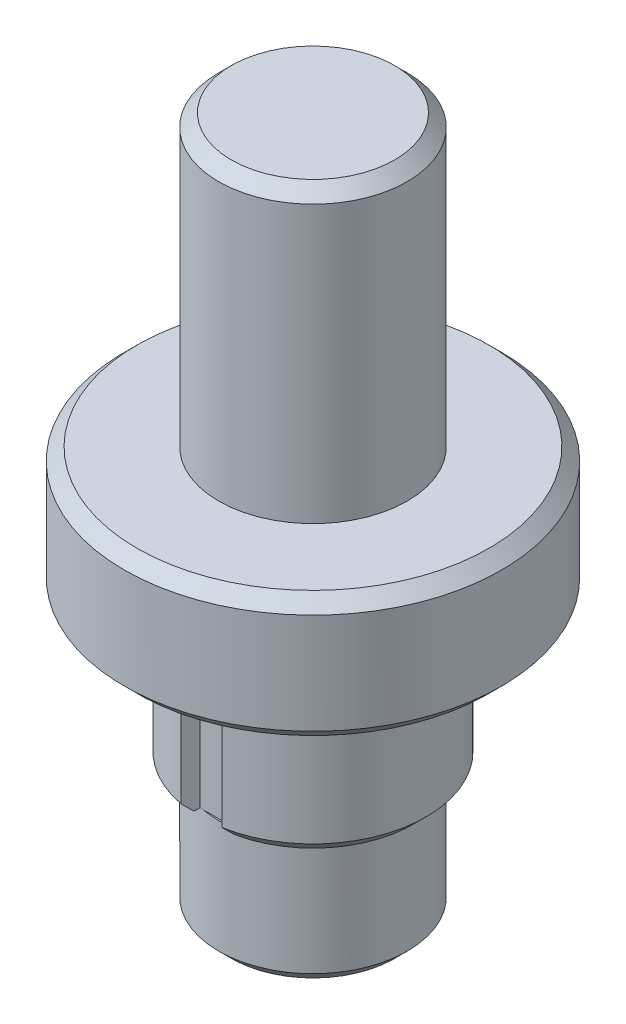
from build123d import *

# Parameters (mm, degrees)
SKETCH2_W          = 3.25
SKETCH2_H          = 3.25
CUT_EXTRUDE1_DEPTH = 12
CHAMFER1_SIZE      = 1


with BuildPart() as part:
    # Sketch1 → Revolve1 (revolve)
    with BuildSketch(Plane.XY, mode=Mode.PRIVATE) as revolve1_sk:
        Polygon((0, 0), (0, 55), (7.5, 55), (7.5, 32), (15, 32), (15, 22), (9, 22), (9, 10), (7.5, 10), (7.5, 0), align=None)
    revolve(revolve1_sk.sketch.rotate(Axis((0, 0, 0), (0, 1, 0)), 90), axis=Axis((0, 0, 0), (0, 1, 0)))

    # Sketch2 → Cut-Extrude1 (cut)
    with BuildSketch(Plane.XZ.offset(-10)):
        with Locations((0, 9)):
            Rectangle(SKETCH2_W, SKETCH2_H)
    extrude(amount=-CUT_EXTRUDE1_DEPTH, mode=Mode.SUBTRACT)

    # Chamfer1
    chamfer1_edges = [part.edges().sort_by_distance(p)[0] for p in [
        (0, 55, 7.5),
        (0, 10, -9),
        (0, 0, 7.5),
        (0, 22, 15),
        (0, 32, 15),
    ]]
    chamfer(chamfer1_edges, length=CHAMFER1_SIZE)


solid = part.part
